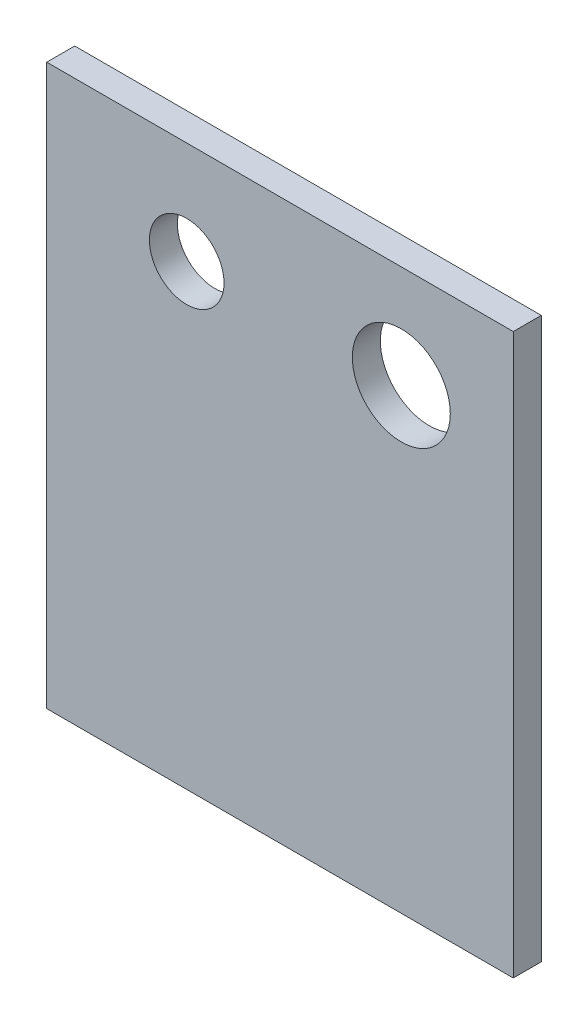
from build123d import *

# Parameters (mm, degrees)
SKETCH1_W           = 50
SKETCH1_H           = 60
SKETCH1_R           = 4
BOSS_EXTRUDE1_DEPTH = 3
SKETCH2_R           = 5.25
CUT_EXTRUDE2_DEPTH  = 40.166312055


with BuildPart() as part:
    # Sketch1 → Boss-Extrude1 (new body)
    with BuildSketch(Plane.XY):
        Rectangle(SKETCH1_W, SKETCH1_H)
        with Locations((-10, 19)):
            Circle(SKETCH1_R, mode=Mode.SUBTRACT)
    extrude(amount=BOSS_EXTRUDE1_DEPTH)

    # Sketch2 → Cut-Extrude2 (cut, through all)
    with BuildSketch(Plane.XY):
        with Locations((13, 19)):
            Circle(SKETCH2_R)
    extrude(amount=CUT_EXTRUDE2_DEPTH, mode=Mode.SUBTRACT)


solid = part.part
